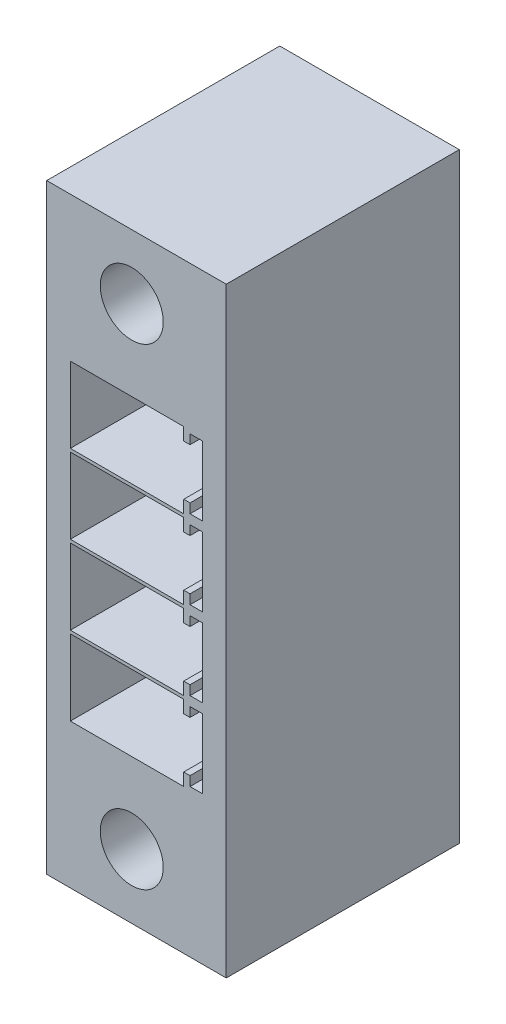
from build123d import *

# Parameters (mm, degrees)
SKETCH1_W           = 9.398
SKETCH1_H           = 24.2316
BOSS_EXTRUDE1_DEPTH = 7.239
HOLE1_D             = 2.54
HOLE1_DEPTH         = 6.35
HOLE1_TIP           = 0.763092986
CUT_EXTRUDE1_REACH  = 16.15


with BuildPart() as part:
    # Sketch1 → Boss-Extrude1 (new body)
    with BuildSketch(Plane(origin=(3.6195, 0, 0), x_dir=(0, 0, -1), z_dir=(1, 0, 0))):
        Rectangle(SKETCH1_W, SKETCH1_H)
    extrude(amount=-BOSS_EXTRUDE1_DEPTH)

    # Hole1
    with Locations(Plane.XY.offset(4.699)):
        with Locations((-0.1905, -9.525), (-0.1905, 9.525)):
            Hole(HOLE1_D / 2, depth=HOLE1_DEPTH)
            with Locations((0, 0, -(HOLE1_DEPTH + HOLE1_TIP / 2))):  # 118° drill point
                Cone(0, HOLE1_D / 2, HOLE1_TIP, mode=Mode.SUBTRACT)

    # Sketch4 → Cut-Extrude1 (cut, up to next)
    with BuildSketch(Plane(origin=(0, 0, -1.651), x_dir=(-1, 0, 0), z_dir=(0, 0, -1)), mode=Mode.PRIVATE) as cut_extrude1_sk1:
        Polygon((2.667, 6.2865), (-1.905, 6.2865), (-1.905, 5.7785), (-2.159, 5.7785), (-2.159, 6.1595), (-2.667, 6.1595), (-2.667, 3.3655), (-2.159, 3.3655), (-2.159, 3.7465), (-1.905, 3.7465), (-1.905, 3.2385), (2.667, 3.2385), align=None)
    cut_extrude1_tool1 = extrude(cut_extrude1_sk1.sketch, amount=-CUT_EXTRUDE1_REACH, mode=Mode.PRIVATE) & part.part
    # Sketch4 → Cut-Extrude1 (cut, up to next)
    with BuildSketch(Plane(origin=(0, 0, -1.651), x_dir=(-1, 0, 0), z_dir=(0, 0, -1)), mode=Mode.PRIVATE) as cut_extrude1_sk2:
        Polygon((2.667, 3.1115), (-1.905, 3.1115), (-1.905, 2.6035), (-2.159, 2.6035), (-2.159, 2.9845), (-2.667, 2.9845), (-2.667, 0.1905), (-2.159, 0.1905), (-2.159, 0.5715), (-1.905, 0.5715), (-1.905, 0.0635), (2.667, 0.0635), align=None)
    cut_extrude1_tool2 = extrude(cut_extrude1_sk2.sketch, amount=-CUT_EXTRUDE1_REACH, mode=Mode.PRIVATE) & part.part
    # Sketch4 → Cut-Extrude1 (cut, up to next)
    with BuildSketch(Plane(origin=(0, 0, -1.651), x_dir=(-1, 0, 0), z_dir=(0, 0, -1)), mode=Mode.PRIVATE) as cut_extrude1_sk3:
        Polygon((2.667, -0.0635), (-1.905, -0.0635), (-1.905, -0.5715), (-2.159, -0.5715), (-2.159, -0.1905), (-2.667, -0.1905), (-2.667, -2.9845), (-2.159, -2.9845), (-2.159, -2.6035), (-1.905, -2.6035), (-1.905, -3.1115), (2.667, -3.1115), align=None)
    cut_extrude1_tool3 = extrude(cut_extrude1_sk3.sketch, amount=-CUT_EXTRUDE1_REACH, mode=Mode.PRIVATE) & part.part
    # Sketch4 → Cut-Extrude1 (cut, up to next)
    with BuildSketch(Plane(origin=(0, 0, -1.651), x_dir=(-1, 0, 0), z_dir=(0, 0, -1)), mode=Mode.PRIVATE) as cut_extrude1_sk4:
        Polygon((2.667, -3.2385), (-1.905, -3.2385), (-1.905, -3.7465), (-2.159, -3.7465), (-2.159, -3.3655), (-2.667, -3.3655), (-2.667, -6.1595), (-2.159, -6.1595), (-2.159, -5.7785), (-1.905, -5.7785), (-1.905, -6.2865), (2.667, -6.2865), align=None)
    cut_extrude1_tool4 = extrude(cut_extrude1_sk4.sketch, amount=-CUT_EXTRUDE1_REACH, mode=Mode.PRIVATE) & part.part
    add(cut_extrude1_tool1.solids().sort_by_distance((-0.052659, 4.7625, -1.651))[0], mode=Mode.SUBTRACT)
    add(cut_extrude1_tool2.solids().sort_by_distance((-0.052659, 1.5875, -1.651))[0], mode=Mode.SUBTRACT)
    add(cut_extrude1_tool3.solids().sort_by_distance((-0.052659, -1.5875, -1.651))[0], mode=Mode.SUBTRACT)
    add(cut_extrude1_tool4.solids().sort_by_distance((-0.052659, -4.7625, -1.651))[0], mode=Mode.SUBTRACT)


solid = part.part
